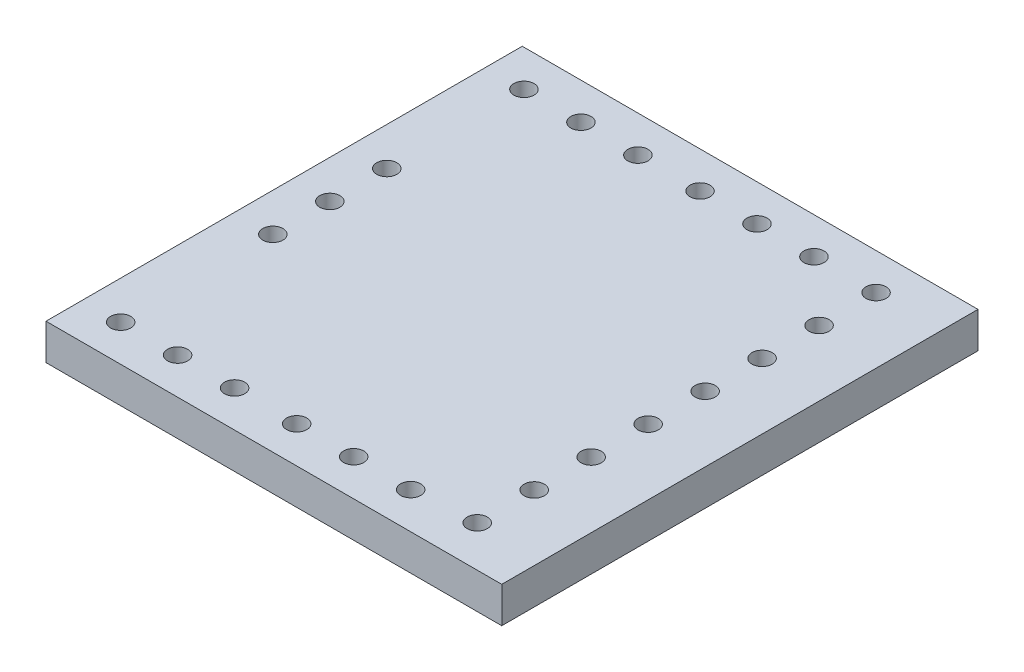
from build123d import *

# Parameters (mm, degrees)
SKETCH_1_W          = 20.32
SKETCH_1_H          = 21.234
EXTRUDE_1_DEPTH     = 1.6
SKETCH_3_R          = 0.45
CUT_EXTRUDE_1_DEPTH = 15.781958226


with BuildPart() as part:
    # Эскиз1 → Бобышка-Вытянуть1 (new body)
    with BuildSketch(Plane(origin=(0, 0, 0), x_dir=(1, 0, 0), z_dir=(0, 1, 0))):
        Rectangle(SKETCH_1_W, SKETCH_1_H)
    extrude(amount=EXTRUDE_1_DEPTH)

    # Эскиз3 → Вырез-Вытянуть1 (cut, through all)
    with BuildSketch(Plane(origin=(0, 1.6, 0), x_dir=(1, 0, 0), z_dir=(0, 1, 0))):
        with Locations(Location((-8.458, 8.991, 0), (0, 0, 270))):
            Circle(SKETCH_3_R)
        with Locations(Location((-5.918, 8.991, 0), (0, 0, 270))):
            Circle(SKETCH_3_R)
        with Locations(Location((-3.378, 8.991, 0), (0, 0, 270))):
            Circle(SKETCH_3_R)
        with Locations(Location((-0.608, 8.991, 0), (0, 0, 270))):
            Circle(SKETCH_3_R)
        with Locations(Location((1.932, 8.991, 0), (0, 0, 270))):
            Circle(SKETCH_3_R)
        with Locations(Location((4.472, 8.991, 0), (0, 0, 270))):
            Circle(SKETCH_3_R)
        with Locations(Location((4.472, -8.991, 0), (0, 0, 90))):
            Circle(SKETCH_3_R)
        with Locations(Location((1.932, -8.991, 0), (0, 0, 90))):
            Circle(SKETCH_3_R)
        with Locations(Location((-0.608, -8.991, 0), (0, 0, 90))):
            Circle(SKETCH_3_R)
        with Locations(Location((-3.378, -8.991, 0), (0, 0, 90))):
            Circle(SKETCH_3_R)
        with Locations(Location((-5.918, -8.991, 0), (0, 0, 90))):
            Circle(SKETCH_3_R)
        with Locations(Location((-8.458, -8.991, 0), (0, 0, 90))):
            Circle(SKETCH_3_R)
        with Locations(Location((7.239, 8.991, 0), (0, 0, 270))):
            Circle(SKETCH_3_R)
        with Locations(Location((7.239, 6.451, 0), (0, 0, 270))):
            Circle(SKETCH_3_R)
        with Locations(Location((7.239, 3.911, 0), (0, 0, 270))):
            Circle(SKETCH_3_R)
        with Locations(Location((7.239, 1.371, 0), (0, 0, 270))):
            Circle(SKETCH_3_R)
        with Locations(Location((7.239, -1.169, 0), (0, 0, 270))):
            Circle(SKETCH_3_R)
        with Locations(Location((7.239, -3.709, 0), (0, 0, 270))):
            Circle(SKETCH_3_R)
        with Locations(Location((7.239, -6.249, 0), (0, 0, 270))):
            Circle(SKETCH_3_R)
        with Locations(Location((7.239, -8.789, 0), (0, 0, 270))):
            Circle(SKETCH_3_R)
        with Locations(Location((-8.457, 2.875, 0), (0, 0, 270))):
            Circle(SKETCH_3_R)
        with Locations(Location((-8.457, 0.335, 0), (0, 0, 270))):
            Circle(SKETCH_3_R)
        with Locations(Location((-8.457, -2.205, 0), (0, 0, 270))):
            Circle(SKETCH_3_R)
    extrude(amount=-CUT_EXTRUDE_1_DEPTH, mode=Mode.SUBTRACT)


solid = part.part
